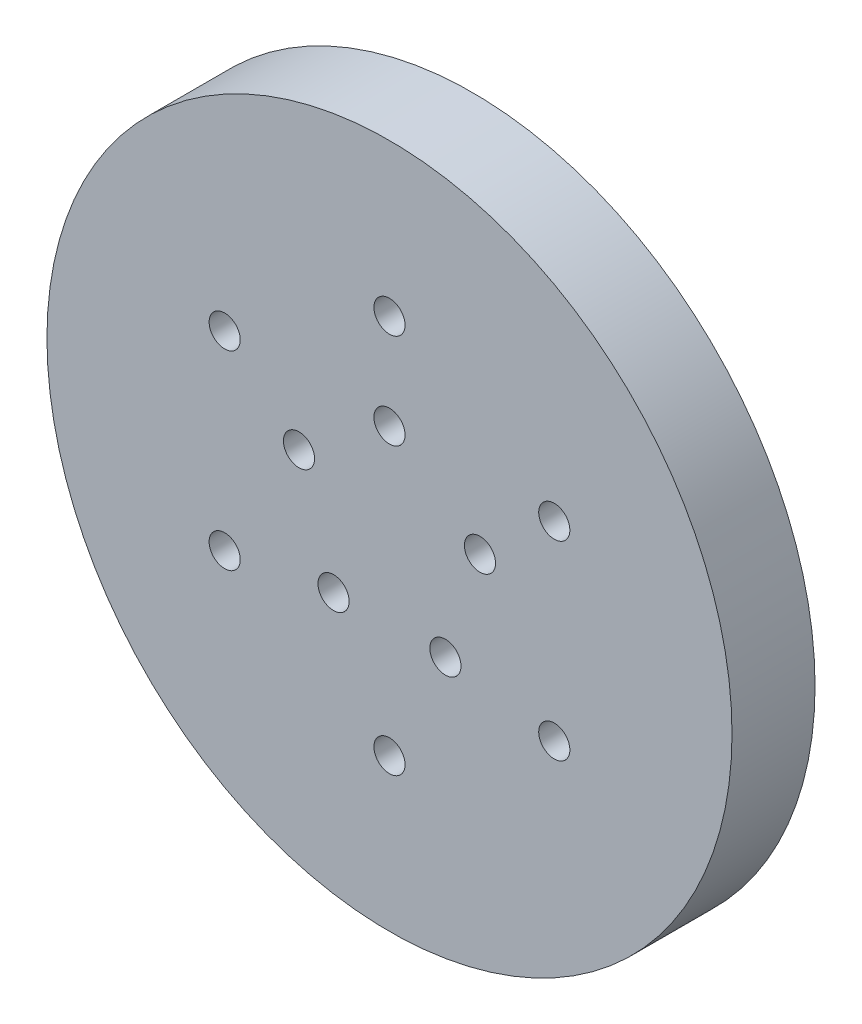
from build123d import *

# Parameters (mm, degrees)
SKETCH1_R           = 16.5
BOSS_EXTRUDE1_DEPTH = 4
SKETCH2_R           = 0.75
CUT_EXTRUDE1_DEPTH  = 24.674881204


with BuildPart() as part:
    # Sketch1 → Boss-Extrude1 (new body)
    with BuildSketch(Plane.XY):
        Circle(SKETCH1_R)
    extrude(amount=BOSS_EXTRUDE1_DEPTH)

    # Sketch2 → Cut-Extrude1 (cut, through all)
    with BuildSketch(Plane.XY.offset(4)):
        with Locations((0, 9.166448404)):
            Circle(SKETCH2_R)
        with Locations((7.93837718, 4.583224202)):
            Circle(SKETCH2_R)
        with Locations((7.93837718, -4.583224202)):
            Circle(SKETCH2_R)
        with Locations((0, -9.166448404)):
            Circle(SKETCH2_R)
        with Locations((-7.93837718, -4.583224202)):
            Circle(SKETCH2_R)
        with Locations((-7.93837718, 4.583224202)):
            Circle(SKETCH2_R)
        with Locations((0, 4.583224202)):
            Circle(SKETCH2_R)
        with Locations((4.358905243, 1.416294167)):
            Circle(SKETCH2_R)
        with Locations((2.693951594, -3.707906268)):
            Circle(SKETCH2_R)
        with Locations((-2.693951594, -3.707906268)):
            Circle(SKETCH2_R)
        with Locations((-4.358905243, 1.416294167)):
            Circle(SKETCH2_R)
    extrude(amount=-CUT_EXTRUDE1_DEPTH, mode=Mode.SUBTRACT)


solid = part.part
